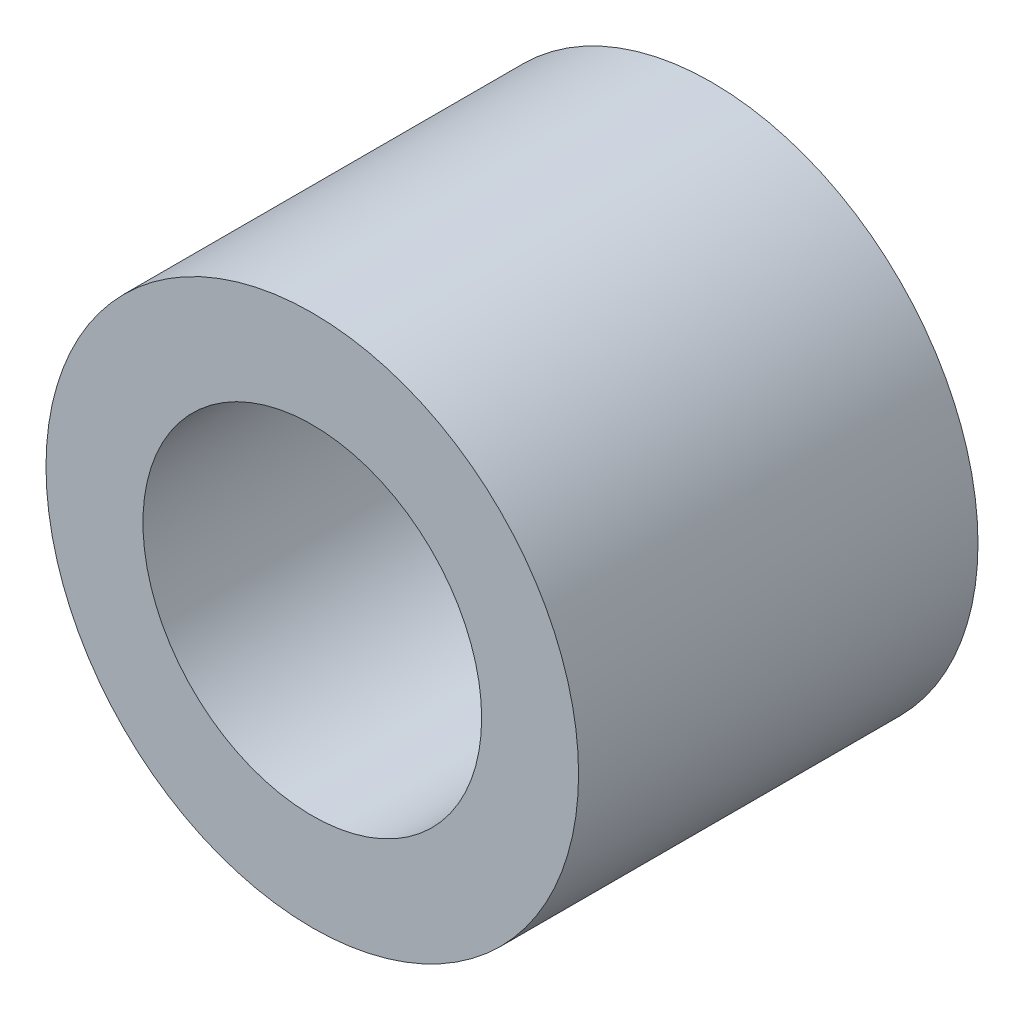
from build123d import *

# Parameters (mm, degrees)
SKETCH1_R           = 25
SKETCH1_R_2         = 15.9
BOSS_EXTRUDE1_DEPTH = 37.5


with BuildPart() as part:
    # Sketch1 → Boss-Extrude1 (new body)
    with BuildSketch(Plane.XY):
        Circle(SKETCH1_R)
        Circle(SKETCH1_R_2, mode=Mode.SUBTRACT)
    extrude(amount=BOSS_EXTRUDE1_DEPTH)


solid = part.part
